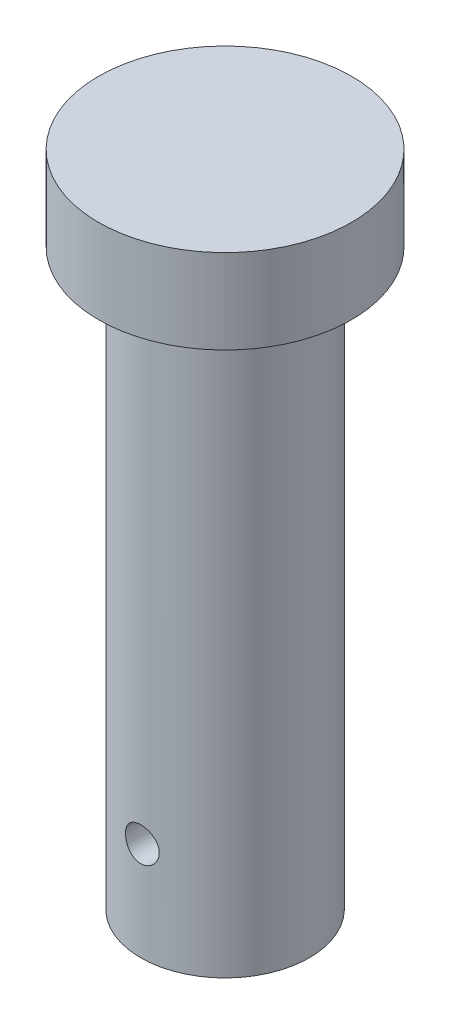
from build123d import *

# Parameters (mm, degrees)
CUT_EXTRUDE1_DEPTH      = 122.249742268
CUT_EXTRUDE1_DEPTH_BACK = 122.249742268
SKETCH2_R               = 3


with BuildPart() as part:
    # Sketch1 → Revolve1 (revolve)
    with BuildSketch(Plane.XY, mode=Mode.PRIVATE) as revolve1_sk:
        Polygon((0, 0), (15, 0), (15, 102), (22.5, 102), (22.5, 117), (0, 117), align=None)
    revolve(revolve1_sk.sketch.rotate(Axis((0, 117, 0), (0, -1, 0)), 180), axis=Axis((0, 117, 0), (0, -1, 0)))

    # Sketch2 → Cut-Extrude1 (cut, two sides: drawn at the far end of the back side and taken through both)
    with BuildSketch(Plane.XY.offset(-CUT_EXTRUDE1_DEPTH_BACK)):
        with Locations((0, 17.5)):
            Circle(SKETCH2_R)
    extrude(amount=CUT_EXTRUDE1_DEPTH + CUT_EXTRUDE1_DEPTH_BACK, mode=Mode.SUBTRACT)


solid = part.part
